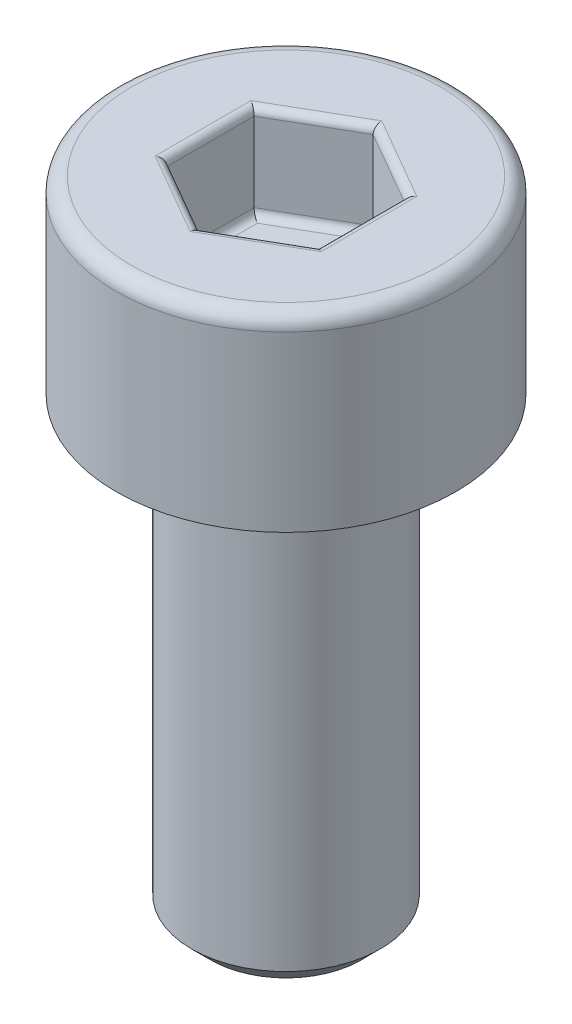
from build123d import *

# Parameters (mm, degrees)
CHAMFER1_SIZE      = 0.25
FILLET1_R          = 0.2
CUT_EXTRUDE1_DEPTH = 1.25
FILLET2_R          = 0.1


with BuildPart() as part:
    # Sketch1 → Revolve1 (revolve)
    with BuildSketch(Plane.XY, mode=Mode.PRIVATE) as revolve1_sk:
        Polygon((0, -8.5), (-1.25, -8.5), (-1.25, -2.5), (-2.25, -2.5), (-2.25, 0), (0, 0), align=None)
    revolve(revolve1_sk.sketch.rotate(Axis((0, 0, 0), (0, -1, 0)), 270), axis=Axis((0, 0, 0), (0, -1, 0)))

    # Chamfer1
    chamfer1_edges = [part.edges().sort_by_distance(p)[0] for p in [
        (0, -2.5, -1.25),
        (0, -8.5, -1.25),
    ]]
    chamfer(chamfer1_edges, length=CHAMFER1_SIZE)

    # Fillet1
    fillet1_edges = [part.edges().sort_by_distance(p)[0] for p in [
        (0, 0, -2.25),
    ]]
    fillet(fillet1_edges, radius=FILLET1_R)

    # Sketch2 → Cut-Extrude1 (cut)
    with BuildSketch(Plane(origin=(0, 0, 0), x_dir=(1, 0, 0), z_dir=(0, 1, 0))):
        Polygon((0, 1.154700538), (-1, 0.577350269), (-1, -0.577350269), (0, -1.154700538), (1, -0.577350269), (1, 0.577350269), align=None)
    extrude(amount=-CUT_EXTRUDE1_DEPTH, mode=Mode.SUBTRACT)

    # Fillet2
    fillet2_edges = [part.edges().sort_by_distance(p)[0] for p in [
        (0.5, -1.25, -0.866025404),
        (1, -1.25, 0),
        (0.5, -1.25, 0.866025404),
        (-0.5, -1.25, 0.866025404),
        (-1, -1.25, 0),
        (-0.5, -1.25, -0.866025404),
        (0.4999999999999987, 0, -0.8660254037844397),
        (-0.5000000000000006, 0, -0.8660254037844395),
        (-1, 0, 0),
        (-0.5000000000000007, 0, 0.8660254037844379),
        (0.4999999999999988, 0, 0.8660254037844382),
        (1, 0, 0),
    ]]
    fillet(fillet2_edges, radius=FILLET2_R)


solid = part.part
